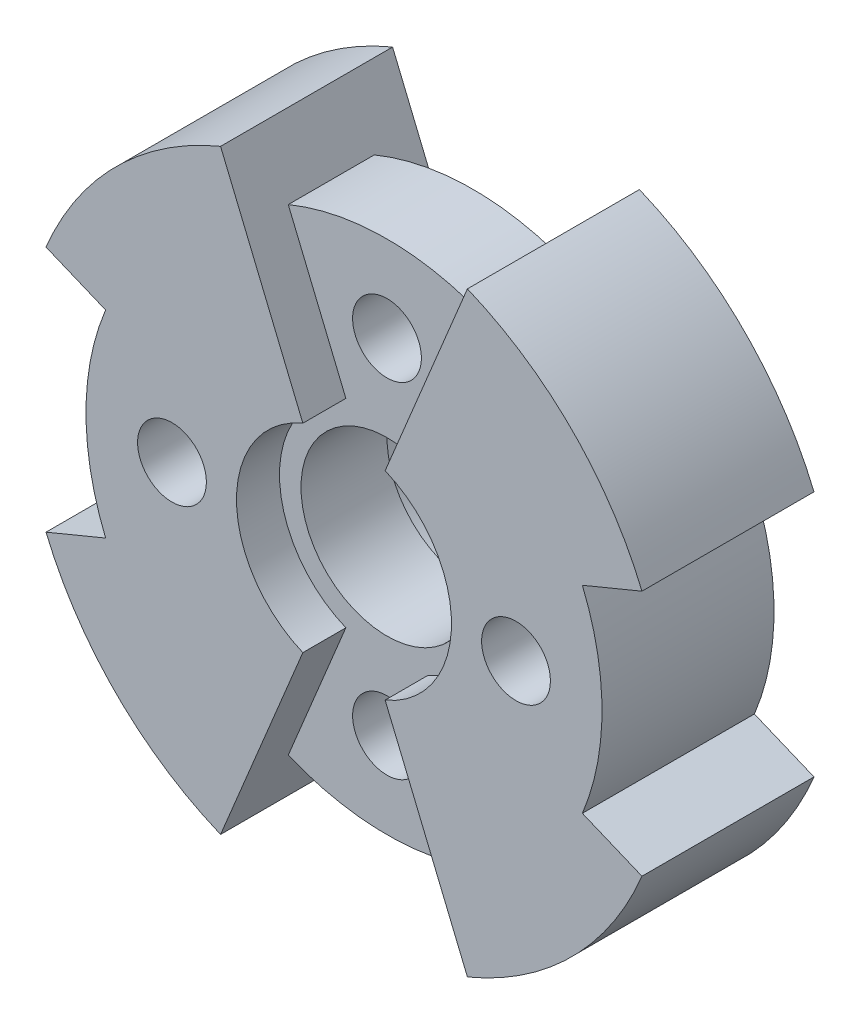
from build123d import *

# Parameters (mm, degrees)
SKETCH1_R             = 203.2
BOSS_EXTRUDE1_DEPTH   = 508
BOSS_EXTRUDE1_2_DEPTH = 508
SKETCH1_3_R           = 203.2
SKETCH1_3_R_2         = 508
BOSS_EXTRUDE2_DEPTH   = 254


with BuildPart() as part:
    # Sketch1 → Boss-Extrude1 (new, symmetric)
    with BuildSketch(Plane.XY):
        with BuildLine():
            Line((729.011938655, 1759.990509434), (243.003979552, 586.663503145))
            ThreePointArc((243.003979552, 586.663503145), (635, 0), (243.003979552, -586.663503145))
            Line((243.003979552, -586.663503145), (729.011938655, -1759.990509434))
            ThreePointArc((729.011938655, -1759.990509434), (1347.03841816, -1347.03841816), (1759.990509434, -729.011938655))
            Line((1759.990509434, -729.011938655), (1407.992407547, -583.209550924))
            ThreePointArc((1407.992407547, -583.209550924), (1524, 0), (1407.992407547, 583.209550924))
            Line((1407.992407547, 583.209550924), (1759.990509434, 729.011938655))
            ThreePointArc((1759.990509434, 729.011938655), (1347.03841816, 1347.03841816), (729.011938655, 1759.990509434))
        make_face()
        with Locations((1016, 0)):
            Circle(SKETCH1_R, mode=Mode.SUBTRACT)
    extrude(amount=BOSS_EXTRUDE1_DEPTH, both=True)



with BuildPart() as body_2:
    # Sketch1 → Boss-Extrude1 2 (new, symmetric)
    with BuildSketch(Plane.XY):
        with BuildLine():
            Line((-1759.990509434, 729.011938655), (-1407.992407547, 583.209550924))
            ThreePointArc((-1407.992407547, 583.209550924), (-1524, 0), (-1407.992407547, -583.209550924))
            Line((-1407.992407547, -583.209550924), (-1759.990509434, -729.011938655))
            ThreePointArc((-1759.990509434, -729.011938655), (-1347.03841816, -1347.03841816), (-729.011938655, -1759.990509434))
            Line((-729.011938655, -1759.990509434), (-243.003979552, -586.663503145))
            ThreePointArc((-243.003979552, -586.663503145), (-635, 0), (-243.003979552, 586.663503145))
            Line((-243.003979552, 586.663503145), (-729.011938655, 1759.990509434))
            ThreePointArc((-729.011938655, 1759.990509434), (-1347.03841816, 1347.03841816), (-1759.990509434, 729.011938655))
        make_face()
        with Locations((-1016, 0)):
            Circle(SKETCH1_R, mode=Mode.SUBTRACT)
    extrude(amount=BOSS_EXTRUDE1_2_DEPTH, both=True)


with BuildPart() as part_1:
    add(part.part)

    add(body_2.part)  # Boss-Extrude2 merges body 2
    # Sketch1<3> → Boss-Extrude2 (add, symmetric)
    with BuildSketch(Plane.XY):
        with BuildLine():
            Line((243.003979552, 586.663503145), (583.209550924, 1407.992407547))
            ThreePointArc((583.209550924, 1407.992407547), (0, 1524), (-583.209550924, 1407.992407547))
            Line((-583.209550924, 1407.992407547), (-243.003979552, 586.663503145))
            ThreePointArc((-243.003979552, 586.663503145), (-635, 0), (-243.003979552, -586.663503145))
            Line((-243.003979552, -586.663503145), (-583.209550924, -1407.992407547))
            ThreePointArc((-583.209550924, -1407.992407547), (0, -1524), (583.209550924, -1407.992407547))
            Line((583.209550924, -1407.992407547), (243.003979552, -586.663503145))
            ThreePointArc((243.003979552, -586.663503145), (635, 0), (243.003979552, 586.663503145))
        make_face()
        with Locations((0, 1016)):
            Circle(SKETCH1_3_R, mode=Mode.SUBTRACT)
        Circle(SKETCH1_3_R_2, mode=Mode.SUBTRACT)
        with Locations((0, -1016)):
            Circle(SKETCH1_3_R, mode=Mode.SUBTRACT)
    extrude(amount=BOSS_EXTRUDE2_DEPTH, both=True)


solid = part_1.part
